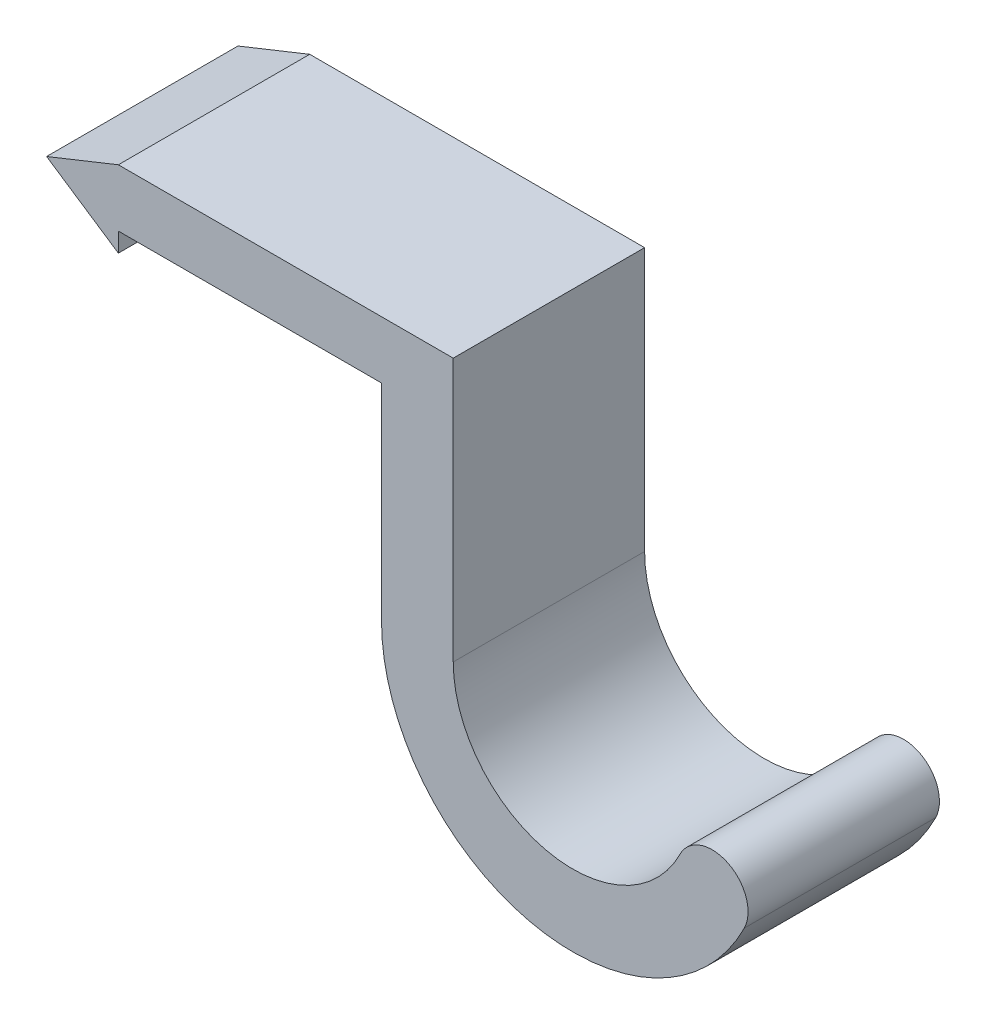
from build123d import *

# Parameters (mm, degrees)
BOSS_EXTRUDE1_DEPTH = 40


with BuildPart() as part:
    # Sketch1 → Boss-Extrude1 (new body)
    with BuildSketch(Plane.XY):
        with BuildLine():
            Line((0, 0), (55, 0))
            Line((55, 0), (55, -43))
            ThreePointArc((55, -43), (85.882739779, -81.947086747), (130.843778303, -60.754536237))
            ThreePointArc((130.843778303, -60.754536237), (127.452045415, -50.70485226), (117.402361439, -54.096585148))
            ThreePointArc((117.402361439, -54.096585148), (89.301712362, -67.341929217), (70, -43))
            Line((70, -43), (70, 12))
            Line((70, 12), (0, 12))
            Line((0, 12), (-15, 6))
            Line((-15, 6), (0, -4))
            Line((0, -4), (0, 0))
        make_face()
    extrude(amount=BOSS_EXTRUDE1_DEPTH)


solid = part.part
